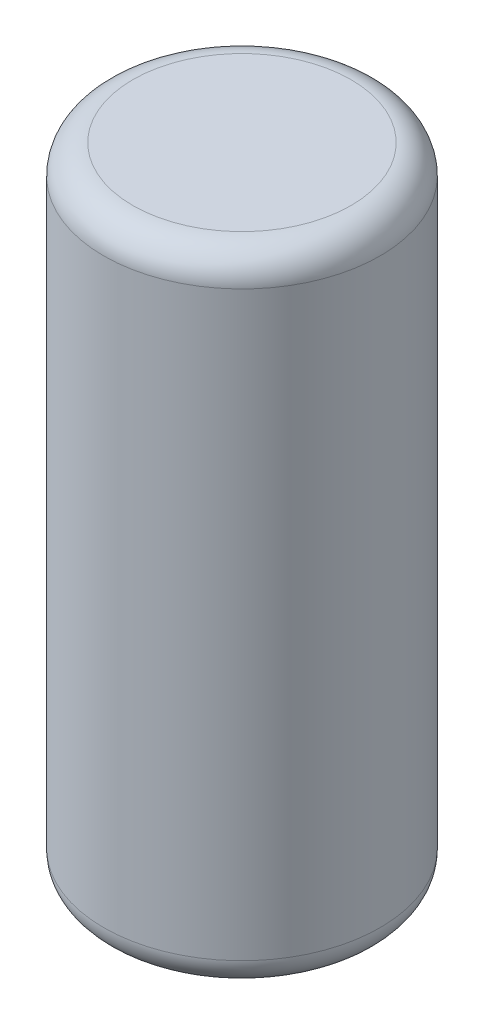
from build123d import *

# Parameters (mm, degrees)
SKETCH_1_R      = 4.75
EXTRUDE_1_DEPTH = 22
FILLET_1_R      = 1


with BuildPart() as part:
    # 草图1 → 凸台-拉伸1 (new body)
    with BuildSketch(Plane(origin=(0, 0, 0), x_dir=(1, 0, 0), z_dir=(0, 1, 0))):
        with Locations(Location((0, 0, 0), (0, 0, 270))):
            Circle(SKETCH_1_R)
    extrude(amount=EXTRUDE_1_DEPTH)

    # 圆角1
    fillet_1_edges = [part.edges().sort_by_distance(p)[0] for p in [
        (0, 0, -4.75),
        (0, 22, -4.75),
    ]]
    fillet(fillet_1_edges, radius=FILLET_1_R)


solid = part.part
